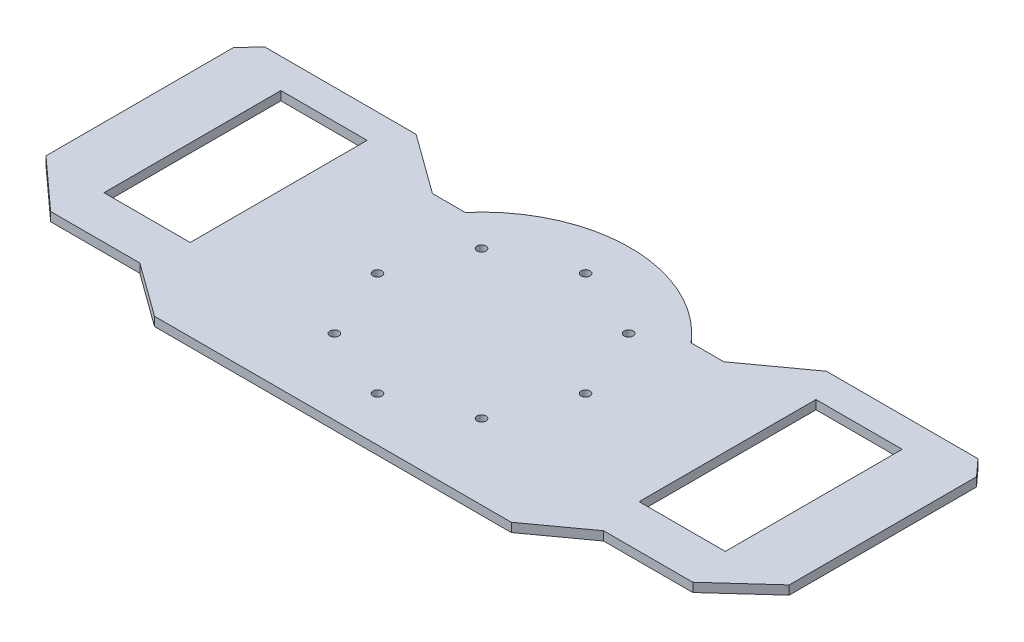
from build123d import *

# Parameters (mm, degrees)
SKETCH1_R           = 1.5
SKETCH1_W           = 29
SKETCH1_H           = 59.5
BOSS_EXTRUDE1_DEPTH = 3


with BuildPart() as part:
    # Sketch1 → Boss-Extrude1 (new body)
    with BuildSketch(Plane(origin=(0, 0, 0), x_dir=(1, 0, 0), z_dir=(0, 1, 0))):
        with BuildLine():
            Line((125, 46.495570398), (125, -16.504429602))
            Line((125, -16.504429602), (108, -31.946538257))
            Line((108, -31.946538257), (78, -31.946538257))
            Line((78, -31.946538257), (60, -45))
            Line((60, -45), (-60, -45))
            Line((-60, -45), (-78, -31.946538257))
            Line((-78, -31.946538257), (-108, -31.946538257))
            Line((-108, -31.946538257), (-125, -16.504429602))
            Line((-125, -16.504429602), (-125, 46.495570398))
            Line((-125, 46.495570398), (-120, 52))
            Line((-120, 52), (-69, 52))
            Line((-69, 52), (-49, 37.496153619))
            Line((-49, 37.496153619), (-38, 37.496153619))
            ThreePointArc((-38, 37.496153619), (0, 55), (38, 37.496153619))
            Line((38, 37.496153619), (49, 37.496153619))
            Line((49, 37.496153619), (69, 52))
            Line((69, 52), (120, 52))
            Line((120, 52), (125, 46.495570398))
        make_face()
        with Locations(Location((-35, 5, 0), (0, 0, 270))):
            Circle(SKETCH1_R, mode=Mode.SUBTRACT)
        with Locations(Location((-24.748737342, -19.748737342, 0), (0, 0, 270))):
            Circle(SKETCH1_R, mode=Mode.SUBTRACT)
        with Locations(Location((0, -30, 0), (0, 0, 270))):
            Circle(SKETCH1_R, mode=Mode.SUBTRACT)
        with Locations(Location((24.748737342, -19.748737342, 0), (0, 0, 270))):
            Circle(SKETCH1_R, mode=Mode.SUBTRACT)
        with Locations(Location((35, 5, 0), (0, 0, 270))):
            Circle(SKETCH1_R, mode=Mode.SUBTRACT)
        with Locations(Location((24.748737342, 29.748737342, 0), (0, 0, 270))):
            Circle(SKETCH1_R, mode=Mode.SUBTRACT)
        with Locations(Location((0, 40, 0), (0, 0, 270))):
            Circle(SKETCH1_R, mode=Mode.SUBTRACT)
        with Locations(Location((-24.748737342, 29.748737342, 0), (0, 0, 270))):
            Circle(SKETCH1_R, mode=Mode.SUBTRACT)
        with Locations((-90, 12.25)):
            Rectangle(SKETCH1_W, SKETCH1_H, mode=Mode.SUBTRACT)
        with Locations((90, 12.25)):
            Rectangle(SKETCH1_W, SKETCH1_H, mode=Mode.SUBTRACT)
    extrude(amount=BOSS_EXTRUDE1_DEPTH)


solid = part.part
